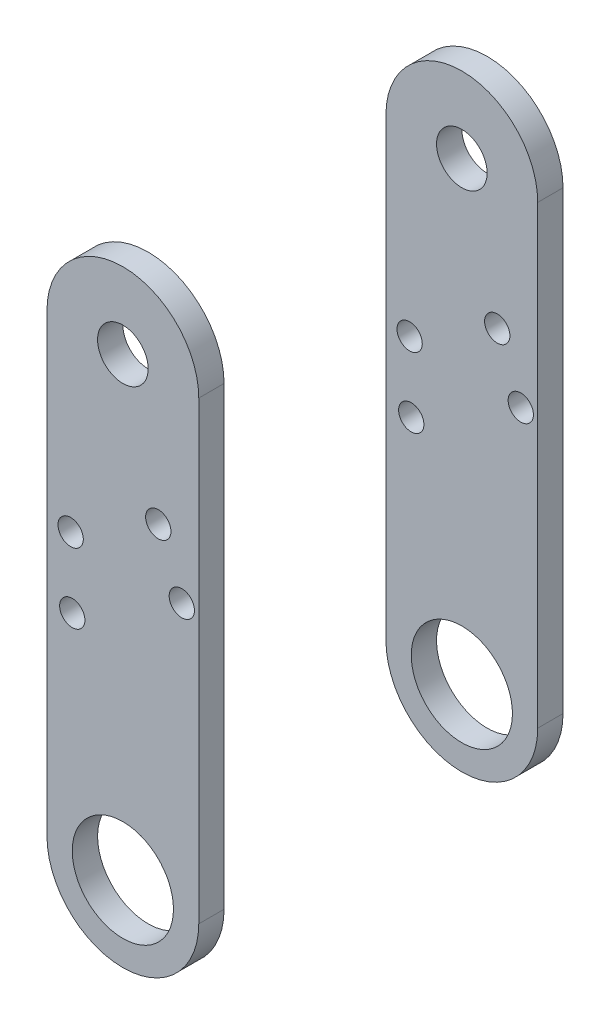
from build123d import *

# Parameters (mm, degrees)
SKETCH_1_R               = 10
SKETCH_1_R_2             = 5
EXTRUDE_1_DEPTH          = 72
SKETCH_2_W               = 62
SKETCH_2_H               = 70
SKETCH_2_H_2             = 67.94057246
CUT_EXTRUDE_1_DEPTH      = 70
EXTRUDE_2_DEPTH          = 62
EXTRUDE_3_DEPTH          = 62
CUT_EXTRUDE_3_DEPTH      = 130.811063026
CUT_EXTRUDE_3_DEPTH_BACK = 130.811063026
SKETCH_6_R               = 2.5
CUT_EXTRUDE_4_DEPTH      = 136.359998088
CUT_EXTRUDE_4_DEPTH_BACK = 136.359998088
SKETCH_7_W               = 62
SKETCH_7_H               = 120


with BuildPart() as part:
    # 草图1 → 凸台-拉伸1 (new body)
    with BuildSketch(Plane.XY):
        with BuildLine():
            Line((-15, 90), (-15, 0))
            ThreePointArc((-15, 0), (0, -15), (15, 0))
            Line((15, 0), (15, 90))
            ThreePointArc((15, 90), (0, 105), (-15, 90))
        make_face()
        Circle(SKETCH_1_R, mode=Mode.SUBTRACT)
        with Locations((0, 90)):
            Circle(SKETCH_1_R_2, mode=Mode.SUBTRACT)
    extrude(amount=EXTRUDE_1_DEPTH)

    # 草图2 → 切除-拉伸1 (cut)
    with BuildSketch(Plane.ZY.offset(15)):
        with Locations((36, 80)):
            Rectangle(SKETCH_2_W, SKETCH_2_H)
        with Locations((36, 11.02971377)):
            Rectangle(SKETCH_2_W, SKETCH_2_H_2)
    extrude(amount=-CUT_EXTRUDE_1_DEPTH, mode=Mode.SUBTRACT)


with BuildPart() as cut_extrude_1_piece_1:
    # of the separate pieces the step leaves, piece 1, a body of its own (cut_extrude_1_pieces)
    add(part.part.solids().sort_by_distance((15, 0, 0))[0])



with BuildPart() as cut_extrude_1_piece_2:
    # of the separate pieces the step leaves, piece 2, a body of its own (cut_extrude_1_pieces)
    add(part.part.solids().sort_by_distance((15, 0, 67))[0])


with BuildPart() as cut_extrude_1_piece_1_1:
    add(cut_extrude_1_piece_1.part)

    add(cut_extrude_1_piece_2.part)  # 凸台-拉伸2 merges 切除-拉伸1 piece 2
    # 草图4 → 凸台-拉伸2 (add)
    with BuildSketch(Plane(origin=(0, 0, 67), x_dir=(-1, 0, 0), z_dir=(0, 0, -1))):
        with BuildLine():
            Line((-4.490156776, 68.758657712), (15, 57.50601045))
            Line((15, 57.50601045), (36.319312502, 12.911360415))
            ThreePointArc((36.319312502, 12.911360415), (35.142094618, 9.577570071), (31.808304274, 10.754787955))
            Line((31.808304274, 10.754787955), (15, 45.913541163))
            Line((15, 45.913541163), (-9.509843224, 60.064305746))
            ThreePointArc((-9.509843224, 60.064305746), (-11.347175983, 66.921324953), (-4.490156776, 68.758657712))
        make_face()
    extrude(amount=EXTRUDE_2_DEPTH)

    # 草图5 → 凸台-拉伸3 (add)
    with BuildSketch(Plane(origin=(0, 0, 67), x_dir=(-1, 0, 0), z_dir=(0, 0, -1))):
        with BuildLine():
            Line((-30.017605928, 49.094069219), (-15, 60.919508718))
            Line((-15, 60.919508718), (12.5, 45.042376315))
            ThreePointArc((12.5, 45.042376315), (14.330127019, 38.212249296), (7.5, 36.382122277))
            Line((7.5, 36.382122277), (-15, 49.372503334))
            Line((-15, 49.372503334), (-27.615908762, 44.780688066))
            ThreePointArc((-27.615908762, 44.780688066), (-30.655195979, 45.913733224), (-30.017605928, 49.094069219))
        make_face()
    extrude(amount=EXTRUDE_3_DEPTH)

    # 草图6 → 切除-拉伸3 (cut, two sides: drawn at the far end of the back side and taken through both)
    with BuildSketch(Plane(origin=(0, 0, 67), x_dir=(-1, 0, 0), z_dir=(0, 0, -1)).offset(-CUT_EXTRUDE_3_DEPTH_BACK)):
        with Locations(Location((-7, 64.411481729, 0), (0, 0, 90))):
            Circle(SKETCH_6_R)
        with Locations(Location((-11.650635095, 53.212249296, 0), (0, 0, 90))):
            Circle(SKETCH_6_R)
        with Locations(Location((10, 40.712249296, 0), (0, 0, 90))):
            Circle(SKETCH_6_R)
        with Locations(Location((10.320508076, 54.411481729, 0), (0, 0, 90))):
            Circle(SKETCH_6_R)
    extrude(amount=CUT_EXTRUDE_3_DEPTH + CUT_EXTRUDE_3_DEPTH_BACK, mode=Mode.SUBTRACT)

    # 草图7 → 切除-拉伸4 (cut, two sides: drawn at the far end of the back side and taken through both)
    with BuildSketch(Plane.ZY.offset(15).offset(-CUT_EXTRUDE_4_DEPTH_BACK)):
        with Locations((36, 45)):
            Rectangle(SKETCH_7_W, SKETCH_7_H)
    extrude(amount=CUT_EXTRUDE_4_DEPTH + CUT_EXTRUDE_4_DEPTH_BACK, mode=Mode.SUBTRACT)


with BuildPart() as cut_extrude_4_piece_1:
    # of the separate pieces the step leaves, piece 1, a body of its own (cut_extrude_4_pieces)
    add(cut_extrude_1_piece_1_1.part.solids().sort_by_distance((-15, 90, 5))[0])


with BuildPart() as cut_extrude_4_piece_2:
    # of the separate pieces the step leaves, piece 2, a body of its own (cut_extrude_4_pieces)
    add(cut_extrude_1_piece_1_1.part.solids().sort_by_distance((15, 0, 67))[0])


solid = Compound([cut_extrude_4_piece_1.part, cut_extrude_4_piece_2.part])
